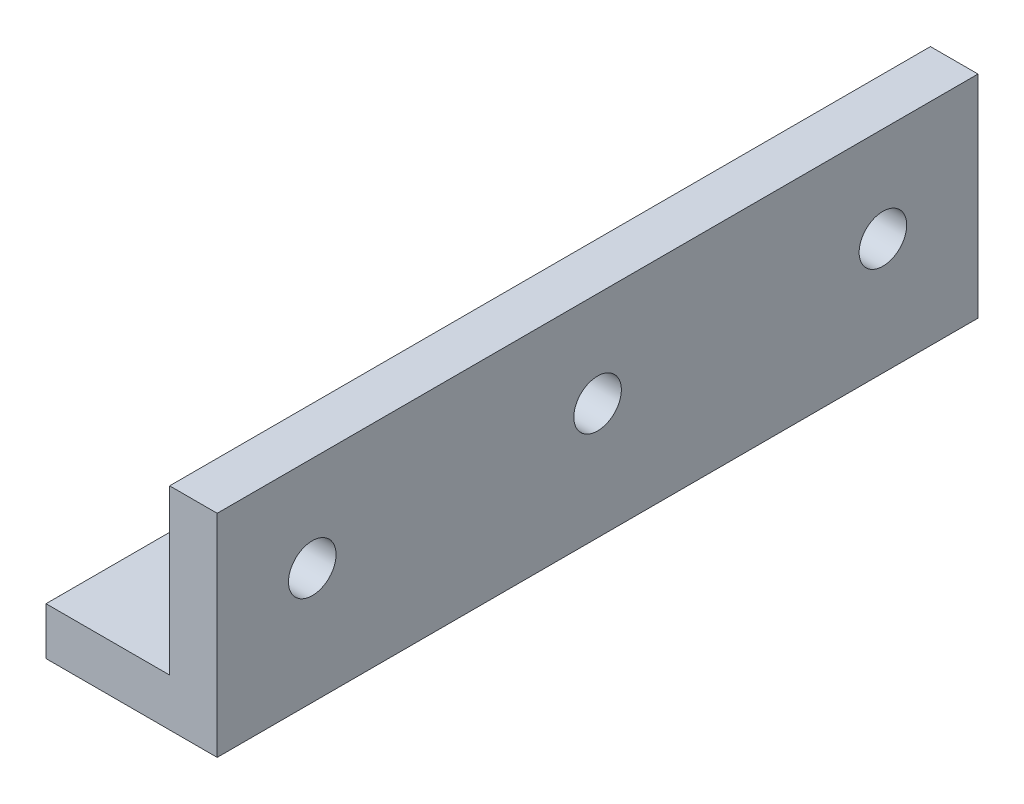
from build123d import *

# Parameters (mm, degrees)
SKETCH1_W           = 22.86
SKETCH1_H           = 101.6
BOSS_EXTRUDE1_DEPTH = 6.35
SKETCH4_W           = 6.35
SKETCH4_H           = 101.6
BOSS_EXTRUDE2_DEPTH = 21.88544518
SKETCH7_R           = 3.175
CUT_EXTRUDE1_DEPTH  = 6.35
SKETCH8_R           = 3.175
CUT_EXTRUDE2_DEPTH  = 6.35


with BuildPart() as part:
    # Sketch1 → Boss-Extrude1 (new body)
    with BuildSketch(Plane(origin=(0, 0, 0), x_dir=(1, 0, 0), z_dir=(0, 1, 0))):
        with Locations((11.43, -50.8)):
            Rectangle(SKETCH1_W, SKETCH1_H)
    extrude(amount=BOSS_EXTRUDE1_DEPTH)

    # Sketch4 → Boss-Extrude2 (add)
    with BuildSketch(Plane(origin=(0, 6.35, 0), x_dir=(1, 0, 0), z_dir=(0, 1, 0))):
        with Locations((19.685, -50.8)):
            Rectangle(SKETCH4_W, SKETCH4_H)
    extrude(amount=BOSS_EXTRUDE2_DEPTH)

    # Sketch7 → Cut-Extrude1 (cut)
    with BuildSketch(Plane.ZY.offset(-16.51)):
        with Locations((88.9, 15.53544518)):
            Circle(SKETCH7_R)
        with Locations((50.8, 15.53544518)):
            Circle(SKETCH7_R)
        with Locations((12.7, 15.53544518)):
            Circle(SKETCH7_R)
    extrude(amount=-CUT_EXTRUDE1_DEPTH, mode=Mode.SUBTRACT)

    # Sketch8 → Cut-Extrude2 (cut)
    with BuildSketch(Plane(origin=(0, 6.35, 0), x_dir=(1, 0, 0), z_dir=(0, 1, 0))):
        with Locations(Location((10.16, -31.75, 0), (0, 0, 270))):
            Circle(SKETCH8_R)
        with Locations(Location((10.16, -69.85, 0), (0, 0, 270))):
            Circle(SKETCH8_R)
    extrude(amount=-CUT_EXTRUDE2_DEPTH, mode=Mode.SUBTRACT)


solid = part.part
